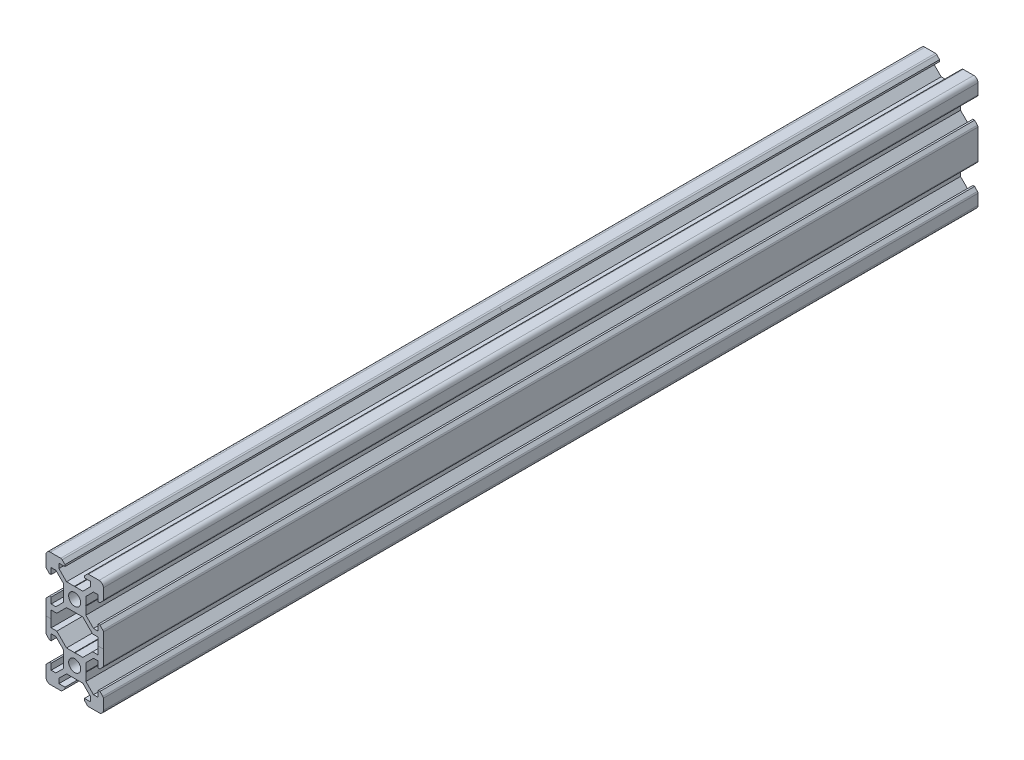
from build123d import *

# Parameters (mm, degrees)
SKETCH1_R           = 2.1
BOSS_EXTRUDE2_DEPTH = 305


with BuildPart() as part:
    # Sketch1 → Boss-Extrude2 (new body)
    with BuildSketch(Plane.XY):
        with BuildLine():
            Line((-8.5, 10), (-4.862792737, 10))
            ThreePointArc((-4.862792737, 10), (-4.598292737, 9.947387679), (-4.374060464, 9.797560464))
            Line((-4.374060464, 9.797560464), (-3.3865, 8.81))
            Line((-3.3865, 8.81), (-3.3865, 8.2))
            Line((-3.3865, 8.2), (-5.5, 8.2))
            Line((-5.5, 8.2), (-5.5, 6.561))
            Line((-5.5, 6.561), (-2.8395, 3.9005))
            Line((-2.8395, 3.9005), (-0.1, 3.9005))
            Line((-0.1, 3.9005), (0, 3.8005))
            Line((0, 3.8005), (0.1, 3.9005))
            Line((0.1, 3.9005), (2.8395, 3.9005))
            Line((2.8395, 3.9005), (5.5, 6.561))
            Line((5.5, 6.561), (5.5, 8.2))
            Line((5.5, 8.2), (3.3865, 8.2))
            Line((3.3865, 8.2), (3.3865, 8.81))
            Line((3.3865, 8.81), (4.374060464, 9.797560464))
            ThreePointArc((4.374060464, 9.797560464), (4.598292737, 9.947387679), (4.862792737, 10))
            Line((4.862792737, 10), (8.5, 10))
            ThreePointArc((8.5, 10), (9.560660172, 9.560660172), (10, 8.5))
            Line((10, 8.5), (10, 4.862792737))
            ThreePointArc((10, 4.862792737), (9.947387679, 4.598292737), (9.797560464, 4.374060464))
            Line((9.797560464, 4.374060464), (8.81, 3.3865))
            Line((8.81, 3.3865), (8.2, 3.3865))
            Line((8.2, 3.3865), (8.2, 5.5))
            Line((8.2, 5.5), (6.561, 5.5))
            Line((6.561, 5.5), (3.9005, 2.8395))
            Line((3.9005, 2.8395), (3.9005, 0.1))
            Line((3.9005, 0.1), (3.8005, 0))
            Line((3.8005, 0), (3.9005, -0.1))
            Line((3.9005, -0.1), (3.9005, -2.8395))
            Line((3.9005, -2.8395), (6.561, -5.5))
            Line((6.561, -5.5), (8.2, -5.5))
            Line((8.2, -5.5), (8.2, -3.3865))
            Line((8.2, -3.3865), (8.81, -3.3865))
            Line((8.81, -3.3865), (9.797560464, -4.374060464))
            ThreePointArc((9.797560464, -4.374060464), (9.947387679, -4.598292737), (10, -4.862792737))
            Line((10, -4.862792737), (10, -15.137207263))
            ThreePointArc((10, -15.137207263), (9.947387679, -15.401707263), (9.797560464, -15.625939536))
            Line((9.797560464, -15.625939536), (8.81, -16.6135))
            Line((8.81, -16.6135), (8.2, -16.6135))
            Line((8.2, -16.6135), (8.2, -14.5))
            Line((8.2, -14.5), (6.561, -14.5))
            Line((6.561, -14.5), (3.9005, -17.1605))
            Line((3.9005, -17.1605), (3.9005, -19.9))
            Line((3.9005, -19.9), (3.8005, -20))
            Line((3.8005, -20), (3.9005, -20.1))
            Line((3.9005, -20.1), (3.9005, -22.8395))
            Line((3.9005, -22.8395), (6.561, -25.5))
            Line((6.561, -25.5), (8.2, -25.5))
            Line((8.2, -25.5), (8.2, -23.3865))
            Line((8.2, -23.3865), (8.81, -23.3865))
            Line((8.81, -23.3865), (9.797560464, -24.374060464))
            ThreePointArc((9.797560464, -24.374060464), (9.947387679, -24.598292737), (10, -24.862792737))
            Line((10, -24.862792737), (10, -28.5))
            ThreePointArc((10, -28.5), (9.560660172, -29.560660172), (8.5, -30))
            Line((8.5, -30), (4.862792737, -30))
            ThreePointArc((4.862792737, -30), (4.598292737, -29.947387679), (4.374060464, -29.797560464))
            Line((4.374060464, -29.797560464), (3.3865, -28.81))
            Line((3.3865, -28.81), (3.3865, -28.2))
            Line((3.3865, -28.2), (5.5, -28.2))
            Line((5.5, -28.2), (5.5, -26.561))
            Line((5.5, -26.561), (2.8395, -23.9005))
            Line((2.8395, -23.9005), (0.1, -23.9005))
            Line((0.1, -23.9005), (0, -23.8005))
            Line((0, -23.8005), (-0.1, -23.9005))
            Line((-0.1, -23.9005), (-2.8395, -23.9005))
            Line((-2.8395, -23.9005), (-5.5, -26.561))
            Line((-5.5, -26.561), (-5.5, -28.2))
            Line((-5.5, -28.2), (-3.3865, -28.2))
            Line((-3.3865, -28.2), (-3.3865, -28.81))
            Line((-3.3865, -28.81), (-4.374060464, -29.797560464))
            ThreePointArc((-4.374060464, -29.797560464), (-4.598292737, -29.947387679), (-4.862792737, -30))
            Line((-4.862792737, -30), (-8.5, -30))
            ThreePointArc((-8.5, -30), (-9.560660172, -29.560660172), (-10, -28.5))
            Line((-10, -28.5), (-10, -24.862792737))
            ThreePointArc((-10, -24.862792737), (-9.947387679, -24.598292737), (-9.797560464, -24.374060464))
            Line((-9.797560464, -24.374060464), (-8.81, -23.3865))
            Line((-8.81, -23.3865), (-8.2, -23.3865))
            Line((-8.2, -23.3865), (-8.2, -25.5))
            Line((-8.2, -25.5), (-6.561, -25.5))
            Line((-6.561, -25.5), (-3.9005, -22.8395))
            Line((-3.9005, -22.8395), (-3.9005, -20.1))
            Line((-3.9005, -20.1), (-3.8005, -20))
            Line((-3.8005, -20), (-3.9005, -19.9))
            Line((-3.9005, -19.9), (-3.9005, -17.1605))
            Line((-3.9005, -17.1605), (-6.561, -14.5))
            Line((-6.561, -14.5), (-8.2, -14.5))
            Line((-8.2, -14.5), (-8.2, -16.6135))
            Line((-8.2, -16.6135), (-8.81, -16.6135))
            Line((-8.81, -16.6135), (-9.797560464, -15.625939536))
            ThreePointArc((-9.797560464, -15.625939536), (-9.947387679, -15.401707263), (-10, -15.137207263))
            Line((-10, -15.137207263), (-10, -4.862792737))
            ThreePointArc((-10, -4.862792737), (-9.947387679, -4.598292737), (-9.797560464, -4.374060464))
            Line((-9.797560464, -4.374060464), (-8.81, -3.3865))
            Line((-8.81, -3.3865), (-8.2, -3.3865))
            Line((-8.2, -3.3865), (-8.2, -5.5))
            Line((-8.2, -5.5), (-6.561, -5.5))
            Line((-6.561, -5.5), (-3.9005, -2.8395))
            Line((-3.9005, -2.8395), (-3.9005, -0.1))
            Line((-3.9005, -0.1), (-3.8005, 0))
            Line((-3.8005, 0), (-3.9005, 0.1))
            Line((-3.9005, 0.1), (-3.9005, 2.8395))
            Line((-3.9005, 2.8395), (-6.561, 5.5))
            Line((-6.561, 5.5), (-8.2, 5.5))
            Line((-8.2, 5.5), (-8.2, 3.3865))
            Line((-8.2, 3.3865), (-8.81, 3.3865))
            Line((-8.81, 3.3865), (-9.797560464, 4.374060464))
            ThreePointArc((-9.797560464, 4.374060464), (-9.947387679, 4.598292737), (-10, 4.862792737))
            Line((-10, 4.862792737), (-10, 8.5))
            ThreePointArc((-10, 8.5), (-9.560660172, 9.560660172), (-8.5, 10))
        make_face()
        Circle(SKETCH1_R, mode=Mode.SUBTRACT)
        with Locations((0, -20)):
            Circle(SKETCH1_R, mode=Mode.SUBTRACT)
        Polygon((-8.2, -12.7), (-8.2, -7.3), (-6.239, -7.3), (-5.5, -6.561), (-2.8395, -3.9005), (-0.1, -3.9005), (0, -3.8005), (0.1, -3.9005), (2.8395, -3.9005), (5.5, -6.561), (6.239, -7.3), (8.2, -7.3), (8.2, -12.7), (6.239, -12.7), (5.5, -13.439), (2.8395, -16.0995), (0.1, -16.0995), (0, -16.1995), (-0.1, -16.0995), (-2.8395, -16.0995), (-5.5, -13.439), (-6.239, -12.7), align=None, mode=Mode.SUBTRACT)
    extrude(amount=BOSS_EXTRUDE2_DEPTH)


solid = part.part
